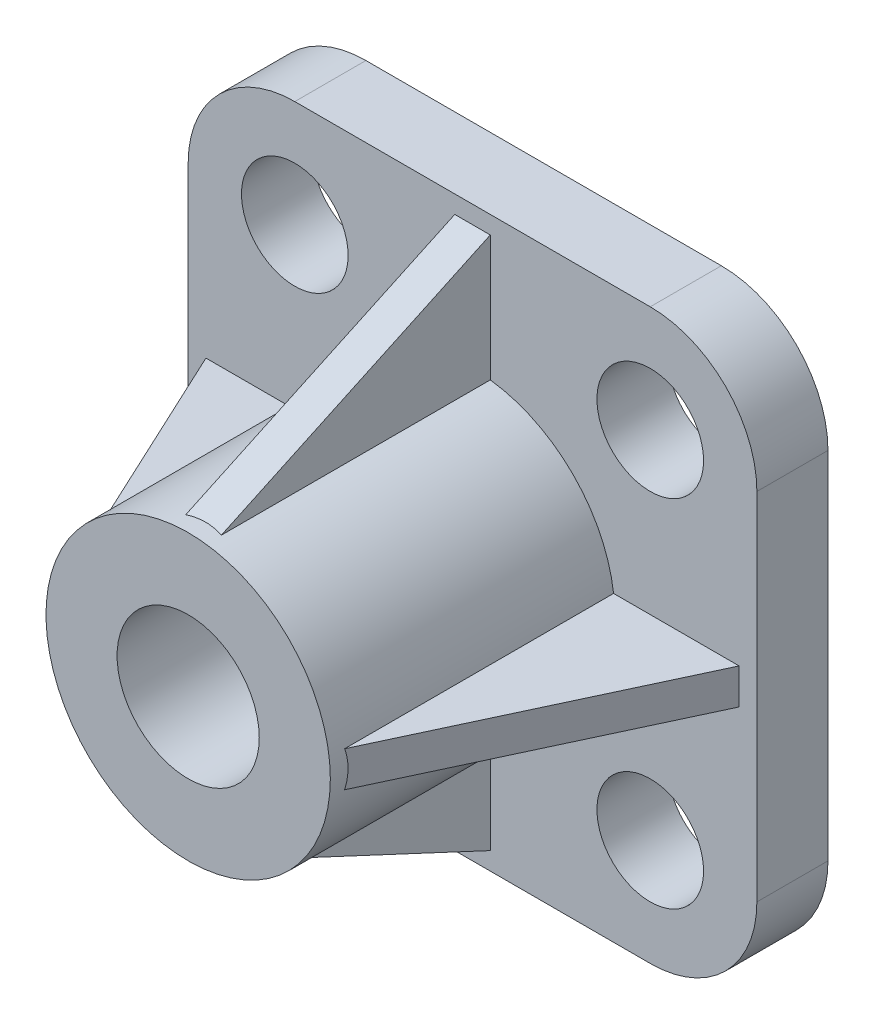
from build123d import *

# Parameters (mm, degrees)
SKETCH1_R           = 15
SKETCH1_R_2         = 20
BOSS_EXTRUDE1_DEPTH = 20
BOSS_EXTRUDE2_START = 80
SKETCH1_4_R         = 40
SKETCH1_4_R_2       = 20
BOSS_EXTRUDE2_DEPTH = 80
RIB14_REACH         = 140.564
SKETCH2_WALL_W      = 361.892855998
SKETCH2_WALL_H      = 10
CIRPATTERN1_COUNT   = 4


with BuildPart() as part:
    # Sketch1 → Boss-Extrude1 (new body)
    with BuildSketch(Plane.XY):
        with BuildLine():
            Line((50, 80), (-50, 80))
            ThreePointArc((-50, 80), (-71.213203436, 71.213203436), (-80, 50))
            Line((-80, 50), (-80, -50))
            ThreePointArc((-80, -50), (-71.213203436, -71.213203436), (-50, -80))
            Line((-50, -80), (50, -80))
            ThreePointArc((50, -80), (71.213203436, -71.213203436), (80, -50))
            Line((80, -50), (80, 50))
            ThreePointArc((80, 50), (71.213203436, 71.213203436), (50, 80))
        make_face()
        with Locations((-50, -50)):
            Circle(SKETCH1_R, mode=Mode.SUBTRACT)
        with Locations((50, -50)):
            Circle(SKETCH1_R, mode=Mode.SUBTRACT)
        with Locations((-50, 50)):
            Circle(SKETCH1_R, mode=Mode.SUBTRACT)
        with Locations((50, 50)):
            Circle(SKETCH1_R, mode=Mode.SUBTRACT)
        Circle(SKETCH1_R_2, mode=Mode.SUBTRACT)
    extrude(amount=-BOSS_EXTRUDE1_DEPTH)

    # Sketch1<4> → Boss-Extrude2 (add)
    with BuildSketch(Plane.XY.offset(BOSS_EXTRUDE2_START)):
        Circle(SKETCH1_4_R)
        Circle(SKETCH1_4_R_2, mode=Mode.SUBTRACT)
    extrude(amount=-BOSS_EXTRUDE2_DEPTH)

    # Sketch2 wall → Rib14 (add, up to next)
    with BuildSketch(Plane(origin=(57.5, 0, 37.5), x_dir=(0.422885465331, 0, -0.906183139995), z_dir=(-0.906183139995, 0, -0.422885465331)), mode=Mode.PRIVATE) as rib14_sk1:
        Rectangle(SKETCH2_WALL_W, SKETCH2_WALL_H)
    rib14_tool1 = extrude(rib14_sk1.sketch, amount=RIB14_REACH, mode=Mode.PRIVATE) - part.part
    rib14 = rib14_tool1.solids().sort_by_distance((57.5, 0, 37.5))[0]
    add(rib14)

    # CirPattern1: Rib14 ×4 about axis
    cirpattern1_axis = Axis((0, 0, 80), (0, 0, 1))
    for i in range(1, CIRPATTERN1_COUNT):
        add(rib14.rotate(cirpattern1_axis, i * 360 / CIRPATTERN1_COUNT))


solid = part.part
